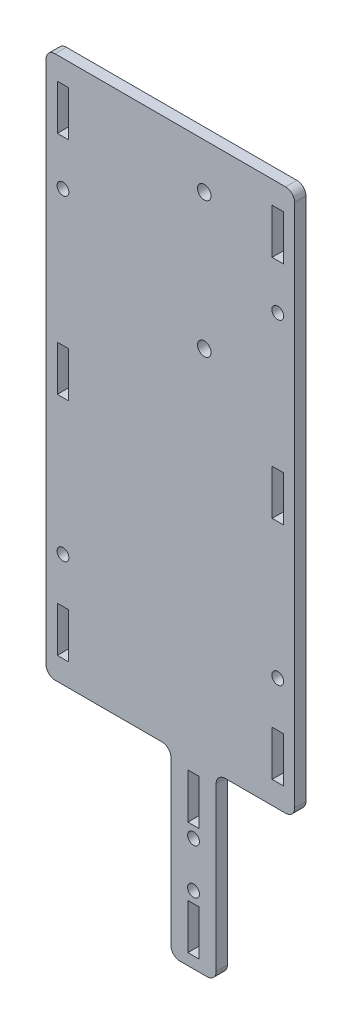
from build123d import *

# Parameters (mm, degrees)
SKETCH1_W           = 69.85
SKETCH1_H           = 152.4
SKETCH1_W_2         = 12.7
SKETCH1_H_2         = 50.8
SKETCH1_W_3         = 3.175
SKETCH1_H_3         = 12.7
BOSS_EXTRUDE1_DEPTH = 3.175
SKETCH3_W           = 3.175
SKETCH3_H           = 12.7
SKETCH3_R           = 1.651
CUT_EXTRUDE3_DEPTH  = 3.175
SKETCH4_R           = 1.651
CUT_EXTRUDE4_DEPTH  = 3.175
FILLET1_R           = 2.54
SKETCH5_R           = 1.905
CUT_EXTRUDE5_DEPTH  = 3.175


with BuildPart() as part:
    # Sketch1 → Boss-Extrude1 (new body)
    # profile 1 of 2: a face of its own
    with BuildSketch(Plane.XY):
        with Locations((34.925, 76.2)):
            Rectangle(SKETCH1_W, SKETCH1_H)
    # profile 2 of 2: a face of its own
    with BuildSketch(Plane.XY):
        with Locations((41.4375, -25.4)):
            Rectangle(SKETCH1_W_2, SKETCH1_H_2)
        with Locations((41.4375, -41.275)):
            Rectangle(SKETCH1_W_3, SKETCH1_H_3, mode=Mode.SUBTRACT)
        with Locations((41.4375, -9.525)):
            Rectangle(SKETCH1_W_3, SKETCH1_H_3, mode=Mode.SUBTRACT)
    extrude(amount=BOSS_EXTRUDE1_DEPTH)

    # Sketch3 → Cut-Extrude3 (cut)
    with BuildSketch(Plane.XY.offset(3.175)):
        with Locations((4.7625, 139.7)):
            Rectangle(SKETCH3_W, SKETCH3_H)
        with Locations((4.7625, 12.7)):
            Rectangle(SKETCH3_W, SKETCH3_H)
        with Locations((65.0875, 139.7)):
            Rectangle(SKETCH3_W, SKETCH3_H)
        with Locations((4.7625, 120.65)):
            Circle(SKETCH3_R)
        with Locations((4.7625, 76.2)):
            Rectangle(SKETCH3_W, SKETCH3_H)
        with Locations((4.7625, 31.75)):
            Circle(SKETCH3_R)
        with Locations((65.0875, 12.7)):
            Rectangle(SKETCH3_W, SKETCH3_H)
        with Locations(Location((65.0875, 31.75, 0), (0, 0, 180))):
            Circle(SKETCH3_R)
        with Locations(Location((65.0875, 120.65, 0), (0, 0, 180))):
            Circle(SKETCH3_R)
        with Locations((65.0875, 76.2)):
            Rectangle(SKETCH3_W, SKETCH3_H)
    extrude(amount=-CUT_EXTRUDE3_DEPTH, mode=Mode.SUBTRACT)

    # Sketch4 → Cut-Extrude4 (cut)
    with BuildSketch(Plane.XY.offset(3.175)):
        with Locations((41.4375, -19.05)):
            Circle(SKETCH4_R)
        with Locations((41.4375, -31.75)):
            Circle(SKETCH4_R)
    extrude(amount=-CUT_EXTRUDE4_DEPTH, mode=Mode.SUBTRACT)

    # Fillet1
    fillet1_edges = [part.edges().sort_by_distance(p)[0] for p in [
        (0, 0, 1.5875),
        (0, 152.4, 1.5875),
        (69.85, 152.4, 1.5875),
        (69.85, 0, 1.5875),
        (47.7875, 0, 1.5875),
        (47.7875, -50.8, 1.5875),
        (35.0875, -50.8, 1.5875),
        (35.0875, 0, 1.5875),
    ]]
    fillet(fillet1_edges, radius=FILLET1_R)

    # Sketch5 → Cut-Extrude5 (cut)
    with BuildSketch(Plane.XY.offset(3.175)):
        with Locations((44.45, 139.7)):
            Circle(SKETCH5_R)
        with Locations((44.45, 101.6)):
            Circle(SKETCH5_R)
    extrude(amount=-CUT_EXTRUDE5_DEPTH, mode=Mode.SUBTRACT)


solid = part.part
